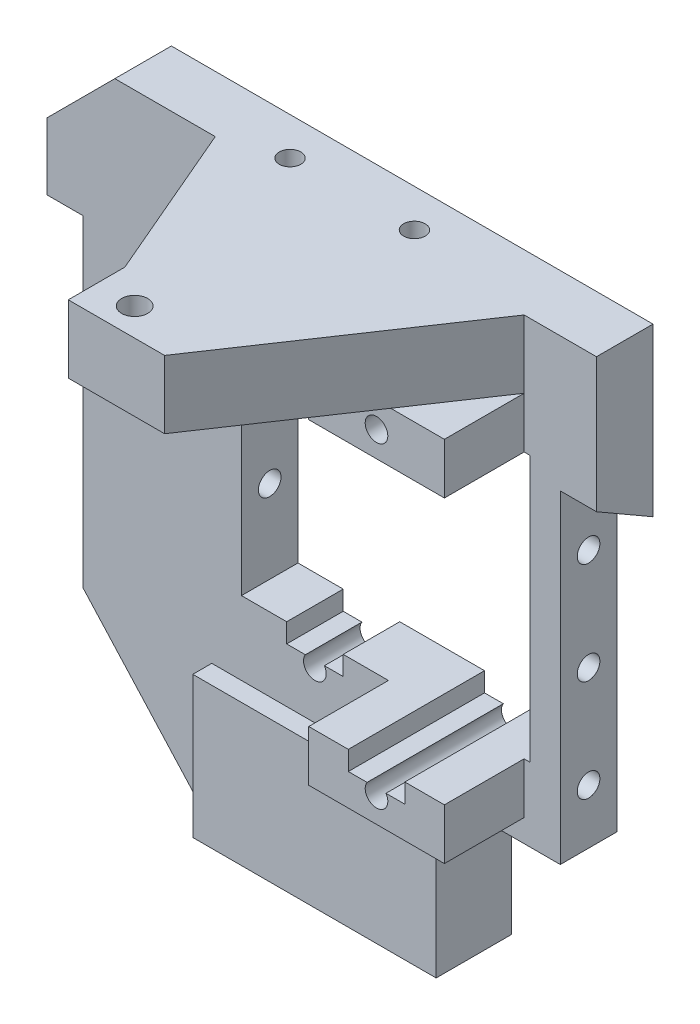
from build123d import *
from build123d.topology import SkipClean

# Parameters (mm, degrees)
SKETCH_1_R          = 1.000029699
SKETCH_1_R_2        = 1.000000092
EXTRUDE_1_DEPTH     = 5
SKETCH_2_W          = 21.526040124
SKETCH_2_H          = 12.5
EXTRUDE_2_DEPTH     = 1.68
SKETCH_3_R          = 0.95
CUT_EXTRUDE_1_DEPTH = 5
SKETCH_4_W          = 12
SKETCH_4_H          = 4.5
SKETCH_4_R          = 1.000000092
EXTRUDE_3_DEPTH     = 7.05
SKETCH_5_R          = 1.149999977
EXTRUDE_4_DEPTH     = 6
CUT_EXTRUDE_START   = -5
SKETCH_6_R          = 0.95
CUT_EXTRUDE_2_DEPTH = 5
SKETCH_7_R          = 1
CUT_EXTRUDE_3_DEPTH = 100
SKETCH_8_R          = 1
CUT_EXTRUDE_4_DEPTH = 3
CUT_EXTRUDE_START_2 = -3
SKETCH_9_R          = 1
CUT_EXTRUDE_5_DEPTH = 3
CUT_EXTRUDE_6_DEPTH = 3.2
CUT_EXTRUDE_7_DEPTH = 3.2


with BuildPart() as part:
    # 草图1 → 凸台-拉伸1 (new body)
    with BuildSketch(Plane.XY):
        Polygon((21.440408464, 11.835070794), (24.640408464, 11.835070794), (24.640408464, 26.596532095), (-17.959592209, 26.596532095), (-23.959592393, 20.596531911), (-23.959592393, 11.805155949), (-20.759591536, 11.805155949), (-20.759591536, -13.834684697), (-9.38563166, -26.403467905), (12.140408464, -26.403467905), (12.140408464, -13.903467905), (21.440408464, -13.903467905), align=None)
        with Locations((-0.265302528, 18.346532095)):
            Circle(SKETCH_1_R, mode=Mode.SUBTRACT)
        with Locations((12.234697472, 18.346532095)):
            Circle(SKETCH_1_R_2, mode=Mode.SUBTRACT)
        with BuildLine():
            ThreePointArc((11.399532521, -9.103467905), (12.234697472, -10.653468153), (13.069862423, -9.103467905))
            Line((13.069862423, -9.103467905), (14.740408464, -9.103467905))
            Line((14.740408464, -9.103467905), (14.740408464, -7.403467905))
            Line((14.740408464, -7.403467905), (18.740408464, -7.403467905))
            Line((18.740408464, -7.403467905), (18.740408464, 16.096532095))
            Line((18.740408464, 16.096532095), (-6.759591536, 16.096532095))
            Line((-6.759591536, 16.096532095), (-6.759591536, -7.403467905))
            Line((-6.759591536, -7.403467905), (-2.759591536, -7.403467905))
            Line((-2.759591536, -7.403467905), (-2.759591536, -9.103467905))
            Line((-2.759591536, -9.103467905), (-1.105259185, -9.103467905))
            ThreePointArc((-1.105259185, -9.103467905), (-0.265302528, -10.657473475), (0.574654129, -9.103467905))
            Line((0.574654129, -9.103467905), (2.240408464, -9.103467905))
            Line((2.240408464, -9.103467905), (2.240408464, -7.403467905))
            Line((2.240408464, -7.403467905), (9.740408464, -7.403467905))
            Line((9.740408464, -7.403467905), (9.740408464, -9.103467905))
            Line((9.740408464, -9.103467905), (11.399532521, -9.103467905))
        make_face(mode=Mode.SUBTRACT)
    extrude(amount=EXTRUDE_1_DEPTH)

    # 草图2 → 凸台-拉伸2 (add)
    with BuildSketch(Plane.XY.offset(5)):
        with Locations((1.377388402, -20.153467905)):
            Rectangle(SKETCH_2_W, SKETCH_2_H)
    extrude(amount=EXTRUDE_2_DEPTH)

    # 草图3 → 切除-拉伸1 (cut)
    with BuildSketch(Plane.XZ.offset(26.403467905)):
        with Locations((-4.122611598, 3.34)):
            Circle(SKETCH_3_R)
        with Locations((6.877388402, 3.34)):
            Circle(SKETCH_3_R)
    extrude(amount=-CUT_EXTRUDE_1_DEPTH, mode=Mode.SUBTRACT)

    # 草图4 → 凸台-拉伸3 (add)
    # profile 1 of 2: a face of its own
    with SkipClean():  # the faces are left unmerged after this step: merging them gives an invalid solid
        with BuildSketch(Plane.XY.offset(5)):
            with BuildLine():
                Line((6.240408464, -7.403467905), (6.240408464, -11.903467905))
                Line((6.240408464, -11.903467905), (18.240408464, -11.903467905))
                Line((18.240408464, -11.903467905), (18.240408464, -7.403467905))
                Line((18.240408464, -7.403467905), (14.740408464, -7.403467905))
                Line((14.740408464, -7.403467905), (14.740408464, -9.103467905))
                Line((14.740408464, -9.103467905), (13.069862423, -9.103467905))
                ThreePointArc((13.069862423, -9.103467905), (12.234697472, -10.653468153), (11.399532521, -9.103467905))
                Line((11.399532521, -9.103467905), (9.740408464, -9.103467905))
                Line((9.740408464, -9.103467905), (9.740408464, -7.403467905))
                Line((9.740408464, -7.403467905), (6.240408464, -7.403467905))
            make_face()
        # profile 2 of 2: a face of its own
        with BuildSketch(Plane.XY.offset(5)):
            with Locations((12.240408464, 18.346532095)):
                Rectangle(SKETCH_4_W, SKETCH_4_H)
            with Locations((12.234697472, 18.346532095)):
                Circle(SKETCH_4_R, mode=Mode.SUBTRACT)
        extrude(amount=EXTRUDE_3_DEPTH)

    # 草图5 → 凸台-拉伸4 (add)
    # profile 1 of 2: a face of its own
    with SkipClean():  # the faces are left unmerged after this step: merging them gives an invalid solid
        with BuildSketch(Plane(origin=(0, 20.596532095, 0), x_dir=(1, 0, 0), z_dir=(0, 1, 0))):
            Polygon((-9.07755609, -5), (-3.077555613, -18.999999523), (-3.077555613, -23.999999285), (5.440409227, -23.999999285), (13.490934884, -12.05), (6.240408464, -12.05), (6.240408464, -5), align=None)
            with Locations(Location((0.328667587, -21.535050638, 0), (0, 0, 270))):
                Circle(SKETCH_5_R, mode=Mode.SUBTRACT)
        # profile 2 of 2: a face of its own
        with BuildSketch(Plane(origin=(0, 20.596532095, 0), x_dir=(1, 0, 0), z_dir=(0, 1, 0))):
            Polygon((18.240408464, -5), (6.240408464, -5), (6.240408464, -12.05), (13.490934884, -12.05), align=None)
        extrude(amount=EXTRUDE_4_DEPTH)

    # 草图6 → 切除-拉伸2 (cut)
    with SkipClean():  # the faces are left unmerged after this step: merging them gives an invalid solid
        with BuildSketch(Plane(origin=(0, 26.596532095, 0), x_dir=(1, 0, 0), z_dir=(0, 1, 0)).offset(CUT_EXTRUDE_START)):
            with Locations((-4.122611598, -3.34)):
                Circle(SKETCH_6_R)
            with Locations((6.877388402, -3.34)):
                Circle(SKETCH_6_R)
        extrude(amount=CUT_EXTRUDE_2_DEPTH, mode=Mode.SUBTRACT)

    # 草图7 → 切除-拉伸3 (cut)
    with SkipClean():  # the faces are left unmerged after this step: merging them gives an invalid solid
        with BuildSketch(Plane(origin=(21.440408464, 0, 0), x_dir=(0, 0, -1), z_dir=(1, 0, 0))):
            with Locations(Location((-2.5, 8.935070794, 0), (0, 0, 90))):
                Circle(SKETCH_7_R)
            with Locations(Location((-2.5, -0.064929206, 0), (0, 0, 90))):
                Circle(SKETCH_7_R)
        extrude(amount=-CUT_EXTRUDE_3_DEPTH, mode=Mode.SUBTRACT)

    # 草图8 → 切除-拉伸4 (cut)
    with SkipClean():  # the faces are left unmerged after this step: merging them gives an invalid solid
        with BuildSketch(Plane(origin=(21.440408464, 0, 0), x_dir=(0, 0, -1), z_dir=(1, 0, 0))):
            with Locations(Location((-2.5, -9.064929206, 0), (0, 0, 90))):
                Circle(SKETCH_8_R)
        extrude(amount=-CUT_EXTRUDE_4_DEPTH, mode=Mode.SUBTRACT)

    # 草图9 → 切除-拉伸5 (cut)
    with SkipClean():  # the faces are left unmerged after this step: merging them gives an invalid solid
        with BuildSketch(Plane.ZY.offset(20.759591536).offset(CUT_EXTRUDE_START_2)):
            with Locations(Location((2.5, -9.064929206, 0), (0, 0, 90))):
                Circle(SKETCH_9_R)
        extrude(amount=CUT_EXTRUDE_5_DEPTH, mode=Mode.SUBTRACT)

    # 草图10 → 切除-拉伸6 (cut)
    with SkipClean():  # the faces are left unmerged after this step: merging them gives an invalid solid
        with BuildSketch(Plane.ZY.offset(23.959592393)):
            Polygon((5, 11.805155949), (0, 11.805155949), (5, 14.691907295), align=None)
        extrude(amount=-CUT_EXTRUDE_6_DEPTH, mode=Mode.SUBTRACT)

    # 草图11 → 切除-拉伸7 (cut)
    with SkipClean():  # the faces are left unmerged after this step: merging them gives an invalid solid
        with BuildSketch(Plane(origin=(24.640408464, 0, 0), x_dir=(0, 0, -1), z_dir=(1, 0, 0))):
            Polygon((0, 11.835070794), (-5, 14.72182214), (-5, 11.835070794), align=None)
        extrude(amount=-CUT_EXTRUDE_7_DEPTH, mode=Mode.SUBTRACT)


solid = part.part
